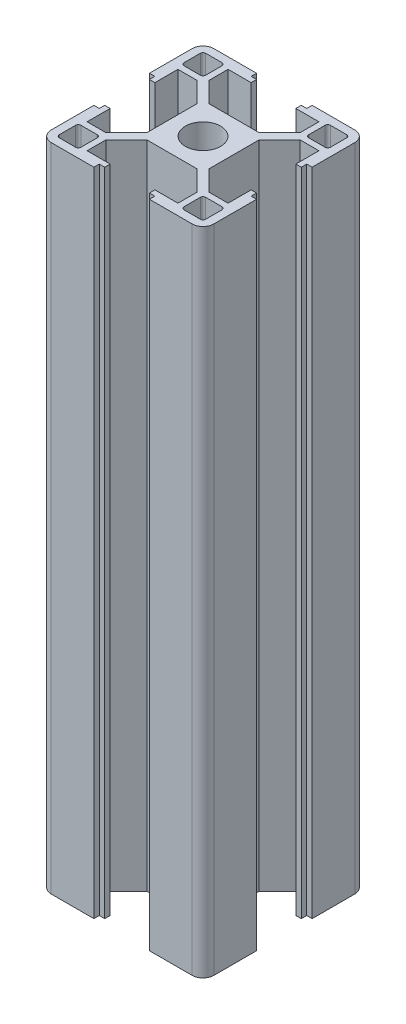
from build123d import *

# Parameters (mm, degrees)
SKETCH1_W           = 4
SKETCH1_H           = 4
SKETCH1_R           = 3.25
BOSS_EXTRUDE1_DEPTH = 120
SKETCH2_W           = 1
SKETCH2_H           = 1
CUT_EXTRUDE1_DEPTH  = 122.86057607
FILLET1_R           = 0.5


with BuildPart() as part:
    # Sketch1 → Boss-Extrude1 (new body)
    with BuildSketch(Plane(origin=(0, 0, 0), x_dir=(1, 0, 0), z_dir=(0, 1, 0))):
        with BuildLine():
            Line((-8.375, 9.50637085), (-8.375, 13))
            Line((-8.375, 13), (-4.125, 13))
            Line((-4.125, 13), (-4.125, 15))
            Line((-4.125, 15), (-13, 15))
            ThreePointArc((-13, 15), (-14.414213562, 14.414213562), (-15, 13))
            Line((-15, 13), (-15, 4.125))
            Line((-15, 4.125), (-13, 4.125))
            Line((-13, 4.125), (-13, 8.375))
            Line((-13, 8.375), (-9.50637085, 8.375))
            Line((-9.50637085, 8.375), (-5.75, 4.61862915))
            Line((-5.75, 4.61862915), (-5.75, -4.61862915))
            Line((-5.75, -4.61862915), (-9.50637085, -8.375))
            Line((-9.50637085, -8.375), (-13, -8.375))
            Line((-13, -8.375), (-13, -4.125))
            Line((-13, -4.125), (-15, -4.125))
            Line((-15, -4.125), (-15, -13))
            ThreePointArc((-15, -13), (-14.414213562, -14.414213562), (-13, -15))
            Line((-13, -15), (-4.125, -15))
            Line((-4.125, -15), (-4.125, -13))
            Line((-4.125, -13), (-8.375, -13))
            Line((-8.375, -13), (-8.375, -9.50637085))
            Line((-8.375, -9.50637085), (-4.61862915, -5.75))
            Line((-4.61862915, -5.75), (4.61862915, -5.75))
            Line((4.61862915, -5.75), (8.375, -9.50637085))
            Line((8.375, -9.50637085), (8.375, -13))
            Line((8.375, -13), (4.125, -13))
            Line((4.125, -13), (4.125, -15))
            Line((4.125, -15), (13, -15))
            ThreePointArc((13, -15), (14.414213562, -14.414213562), (15, -13))
            Line((15, -13), (15, -4.125))
            Line((15, -4.125), (13, -4.125))
            Line((13, -4.125), (13, -8.375))
            Line((13, -8.375), (9.50637085, -8.375))
            Line((9.50637085, -8.375), (5.75, -4.61862915))
            Line((5.75, -4.61862915), (5.75, 4.61862915))
            Line((5.75, 4.61862915), (9.50637085, 8.375))
            Line((9.50637085, 8.375), (13, 8.375))
            Line((13, 8.375), (13, 4.125))
            Line((13, 4.125), (15, 4.125))
            Line((15, 4.125), (15, 13))
            ThreePointArc((15, 13), (14.414213562, 14.414213562), (13, 15))
            Line((13, 15), (4.125, 15))
            Line((4.125, 15), (4.125, 13))
            Line((4.125, 13), (8.375, 13))
            Line((8.375, 13), (8.375, 9.50637085))
            Line((8.375, 9.50637085), (4.61862915, 5.75))
            Line((4.61862915, 5.75), (-4.61862915, 5.75))
            Line((-4.61862915, 5.75), (-8.375, 9.50637085))
        make_face()
        with Locations((-11.5, -11.5)):
            Rectangle(SKETCH1_W, SKETCH1_H, mode=Mode.SUBTRACT)
        with Locations((11.5, -11.5)):
            Rectangle(SKETCH1_W, SKETCH1_H, mode=Mode.SUBTRACT)
        Polygon((-9.5, 9.5), (-10.63137085, 9.5), (-13.5, 9.5), (-13.5, 13.5), (-9.5, 13.5), align=None, mode=Mode.SUBTRACT)
        with Locations(Location((0, 0, 0), (0, 0, 270))):
            Circle(SKETCH1_R, mode=Mode.SUBTRACT)
        with Locations((11.5, 11.5)):
            Rectangle(SKETCH1_W, SKETCH1_H, mode=Mode.SUBTRACT)
    extrude(amount=BOSS_EXTRUDE1_DEPTH)

    # Sketch2 → Cut-Extrude1 (cut, through all)
    with BuildSketch(Plane(origin=(0, 120, 0), x_dir=(1, 0, 0), z_dir=(0, 1, 0))):
        with Locations((14.5, 4.625)):
            Rectangle(SKETCH2_W, SKETCH2_H)
        with Locations((-4.625, 14.5)):
            Rectangle(SKETCH2_W, SKETCH2_H)
        with Locations((4.625, 14.5)):
            Rectangle(SKETCH2_W, SKETCH2_H)
        with Locations((14.5, -4.625)):
            Rectangle(SKETCH2_W, SKETCH2_H)
        with Locations((4.625, -14.5)):
            Rectangle(SKETCH2_W, SKETCH2_H)
        with Locations((-4.625, -14.5)):
            Rectangle(SKETCH2_W, SKETCH2_H)
        with Locations((-14.5, -4.625)):
            Rectangle(SKETCH2_W, SKETCH2_H)
        with Locations((-14.5, 4.625)):
            Rectangle(SKETCH2_W, SKETCH2_H)
    extrude(amount=-CUT_EXTRUDE1_DEPTH, mode=Mode.SUBTRACT)

    # Fillet1
    fillet1_edges = [part.edges().sort_by_distance(p)[0] for p in [
        (-9.5, 60, -13.5),
        (-13.5, 60, -13.5),
        (-13.5, 60, -9.5),
        (-9.5, 60, -9.5),
        (-9.5, 60, 9.5),
        (-13.5, 60, 9.5),
        (-13.5, 60, 13.5),
        (-9.5, 60, 13.5),
        (9.5, 60, -9.5),
        (13.5, 60, -9.5),
        (13.5, 60, -13.5),
        (9.5, 60, -13.5),
        (13.5, 60, 13.5),
        (13.5, 60, 9.5),
        (9.5, 60, 9.5),
        (9.5, 60, 13.5),
    ]]
    fillet(fillet1_edges, radius=FILLET1_R)


solid = part.part
